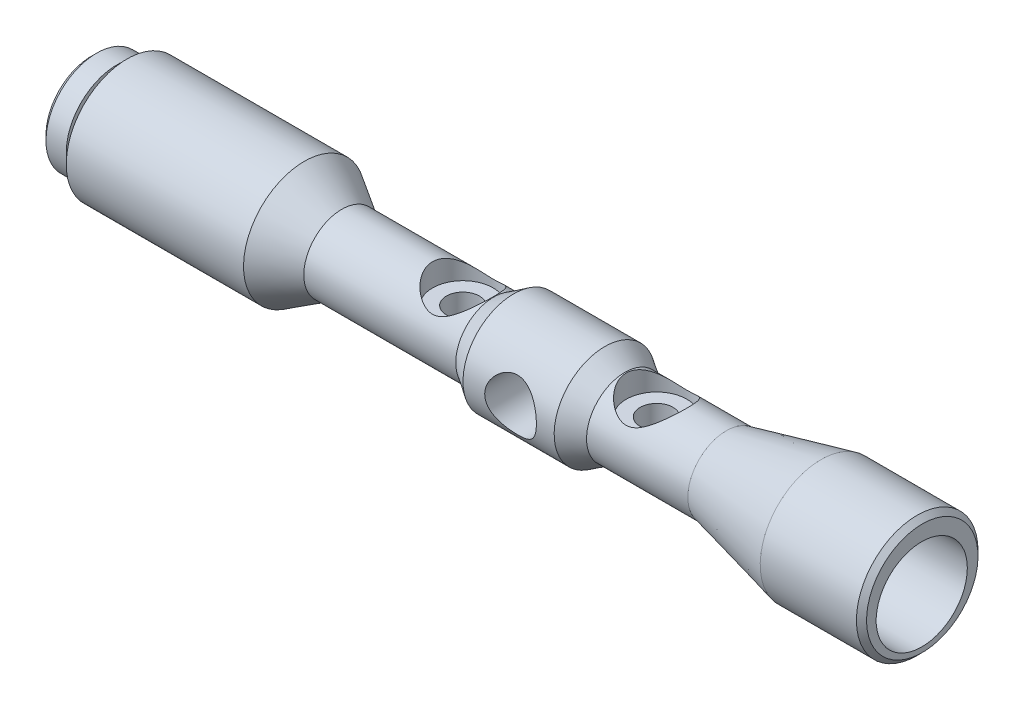
from build123d import *

# Parameters (mm, degrees)
HOLE_WIZARD_9_D            = 10
HOLE_WIZARD_9_DEPTH        = 50
HOLE_WIZARD_9_CBORE_D      = 14
HOLE_WIZARD_9_CBORE_DEPTH  = 20
HOLE_WIZARD_9_TIP          = 2.886751346
HOLE_WIZARD_M12_1_D        = 10.2
HOLE_WIZARD_M12_1_DEPTH    = 12
HOLE_WIZARD_M12_1_TIP      = 3.064389157
CHAMFER_1_SIZE             = 1
CHAMFER_2_SIZE             = 1
HOLE_WIZARD_12_D           = 10
HOLE_WIZARD_12_DEPTH       = 40
HOLE_WIZARD_12_CBORE_D     = 18
HOLE_WIZARD_12_CBORE_DEPTH = 20
HOLE_WIZARD_12_TIP         = 2.886751346
HOLE_WIZARD_14_D           = 6.5
HOLE_WIZARD_14_DEPTH       = 100
HOLE_WIZARD_14_CBORE_D     = 12
HOLE_WIZARD_14_CBORE_DEPTH = 4.5
HOLE_WIZARD_15_D           = 6.5
HOLE_WIZARD_15_DEPTH       = 100
HOLE_WIZARD_15_CBORE_D     = 12
HOLE_WIZARD_15_CBORE_DEPTH = 4.5


with BuildPart() as part:
    # 草图2 → 旋转2 (revolve)
    with BuildSketch(Plane.XY, mode=Mode.PRIVATE) as revolve_2_sk:
        Polygon((0, 10), (0, 0), (164, 0), (164, 12), (144, 12), (125.3, 7.582380862), (105.3, 7.582380862), (101.324359639, 10), (83.324359639, 10), (79.4, 7.5), (49.4, 7.5), (42, 12), (7, 12), (7, 8.5), (5, 8.5), (5, 10), align=None)
    revolve(revolve_2_sk.sketch.rotate(Axis((0, 0, 0), (1, 0, 0)), 180), axis=Axis((0, 0, 0), (1, 0, 0)))

    # 孔9
    with Locations(Plane.ZY):
        with Locations((0, 0)):
            CounterBoreHole(HOLE_WIZARD_9_D / 2, HOLE_WIZARD_9_CBORE_D / 2, HOLE_WIZARD_9_CBORE_DEPTH, depth=HOLE_WIZARD_9_DEPTH)
            with Locations((0, 0, -(HOLE_WIZARD_9_DEPTH + HOLE_WIZARD_9_TIP / 2))):  # 120° drill point
                Cone(0, HOLE_WIZARD_9_D / 2, HOLE_WIZARD_9_TIP, mode=Mode.SUBTRACT)

    # M12 螺纹孔1
    with Locations(Plane(origin=(92.712048687, 0.00356299, 9.999999365), x_dir=(0, 0.999999936526, -0.000356298984), z_dir=(0, 0.000356298984, 0.999999936526))):
        with Locations((0, 0)):
            Hole(HOLE_WIZARD_M12_1_D / 2, depth=HOLE_WIZARD_M12_1_DEPTH)
            with Locations((0, 0, -(HOLE_WIZARD_M12_1_DEPTH + HOLE_WIZARD_M12_1_TIP / 2))):  # 118° drill point
                Cone(0, HOLE_WIZARD_M12_1_D / 2, HOLE_WIZARD_M12_1_TIP, mode=Mode.SUBTRACT)

    # 倒角1
    chamfer_1_edges = [part.edges().sort_by_distance(p)[0] for p in [
        (164, 12, 0),
    ]]
    chamfer(chamfer_1_edges, length=CHAMFER_1_SIZE)

    # 倒角2
    chamfer_2_edges = [part.edges().sort_by_distance(p)[0] for p in [
        (0, 10, 0),
    ]]
    chamfer(chamfer_2_edges, length=CHAMFER_2_SIZE)

    # 孔12
    with Locations(Plane(origin=(164, 0, 0), x_dir=(0, 0, -1), z_dir=(1, 0, 0))):
        with Locations((-0.105297268, -0.976154466)):
            CounterBoreHole(HOLE_WIZARD_12_D / 2, HOLE_WIZARD_12_CBORE_D / 2, HOLE_WIZARD_12_CBORE_DEPTH, depth=HOLE_WIZARD_12_DEPTH)
            with Locations((0, 0, -(HOLE_WIZARD_12_DEPTH + HOLE_WIZARD_12_TIP / 2))):  # 120° drill point
                Cone(0, HOLE_WIZARD_12_D / 2, HOLE_WIZARD_12_TIP, mode=Mode.SUBTRACT)

    # 孔14
    with Locations(Plane(origin=(73.309592569, 7.499999992, 0.000348053), x_dir=(0, -4.6407092e-05, 0.999999998923), z_dir=(0, 0.999999998923, 4.6407092e-05))):
        with Locations((0, 0)):
            CounterBoreHole(HOLE_WIZARD_14_D / 2, HOLE_WIZARD_14_CBORE_D / 2, HOLE_WIZARD_14_CBORE_DEPTH, depth=HOLE_WIZARD_14_DEPTH)

    # 孔15
    with Locations(Plane(origin=(111.545186108, 7.582371257, 0.012068763), x_dir=(0, -0.001591685193, 0.999998733268), z_dir=(0, 0.999998733268, 0.001591685193))):
        with Locations((0, 0)):
            CounterBoreHole(HOLE_WIZARD_15_D / 2, HOLE_WIZARD_15_CBORE_D / 2, HOLE_WIZARD_15_CBORE_DEPTH, depth=HOLE_WIZARD_15_DEPTH)


solid = part.part
